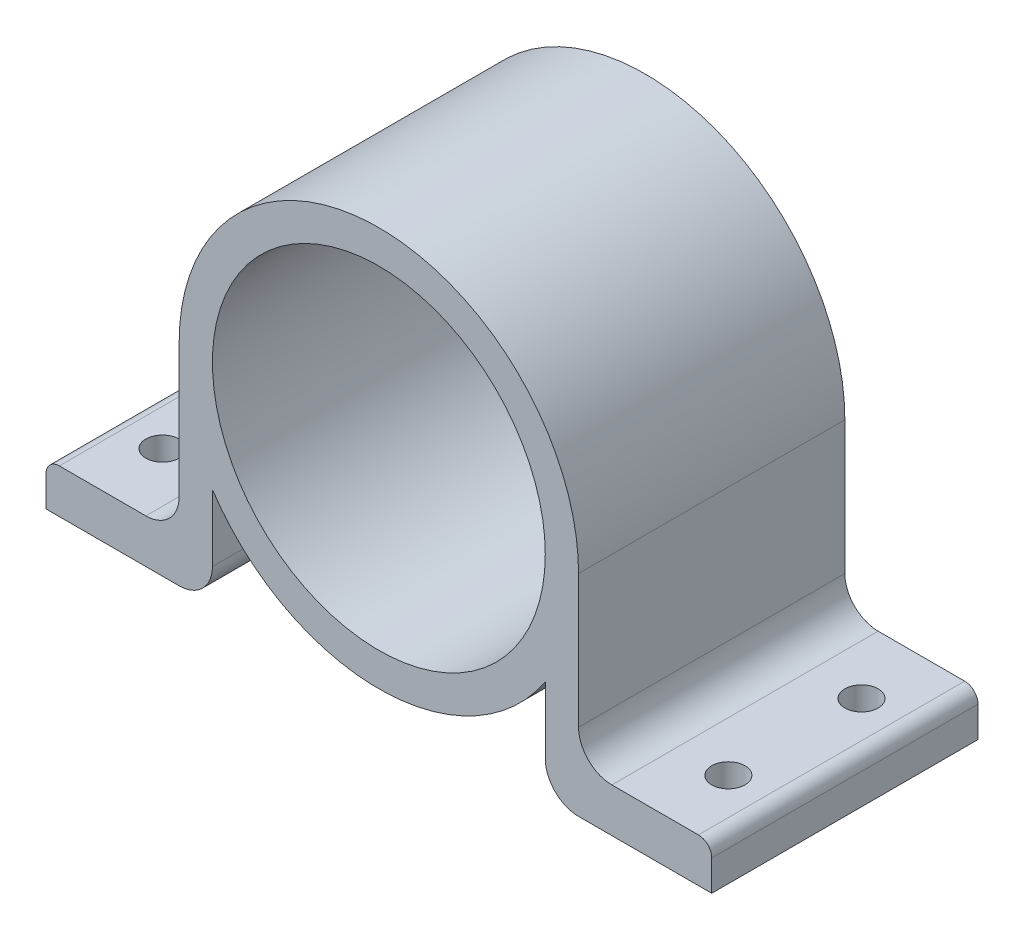
from build123d import *

# Parameters (mm, degrees)
SKETCH1_R           = 12.5
BOSS_EXTRUDE1_DEPTH = 20
FILLET1_R           = 2.5
CUT_EXTRUDE1_REACH  = 44.205
SKETCH2_R           = 1.25
FILLET3_R           = 1
FILLET4_R           = 2.5


with BuildPart() as part:
    # Sketch1 → Boss-Extrude1 (new body)
    with BuildSketch(Plane.XY):
        with BuildLine():
            Line((-25, 6.526152156), (-15, 6.526152156))
            Line((-15, 6.526152156), (-15, 19.026152156))
            ThreePointArc((-15, 19.026152156), (0, 34.026152156), (15, 19.026152156))
            Line((15, 19.026152156), (15, 6.526152156))
            Line((15, 6.526152156), (25, 6.526152156))
            Line((25, 6.526152156), (25, 3.226152156))
            Line((25, 3.226152156), (12.5, 3.226152156))
            Line((12.5, 3.226152156), (12.5, 10.73459018))
            ThreePointArc((12.5, 10.73459018), (0, 4.026152156), (-12.5, 10.73459018))
            Line((-12.5, 10.73459018), (-12.5, 3.226152156))
            Line((-12.5, 3.226152156), (-25, 3.226152156))
            Line((-25, 3.226152156), (-25, 6.526152156))
        make_face()
        with Locations((0, 19.026152156)):
            Circle(SKETCH1_R, mode=Mode.SUBTRACT)
    extrude(amount=BOSS_EXTRUDE1_DEPTH)

    # Fillet1
    fillet1_edges = [part.edges().sort_by_distance(p)[0] for p in [
        (-15, 6.526152156, 10),
        (15, 6.526152156, 10),
    ]]
    fillet(fillet1_edges, radius=FILLET1_R)

    # Sketch2 → Cut-Extrude1 (cut, up to next)
    with BuildSketch(Plane(origin=(0, 6.526152156, 0), x_dir=(1, 0, 0), z_dir=(0, 1, 0)), mode=Mode.PRIVATE) as cut_extrude1_sk1:
        with Locations(Location((-21.25, -5, 0), (0, 0, 270))):
            Circle(SKETCH2_R)
    cut_extrude1_tool1 = extrude(cut_extrude1_sk1.sketch, amount=-CUT_EXTRUDE1_REACH, mode=Mode.PRIVATE) & part.part
    # Sketch2 → Cut-Extrude1 (cut, up to next)
    with BuildSketch(Plane(origin=(0, 6.526152156, 0), x_dir=(1, 0, 0), z_dir=(0, 1, 0)), mode=Mode.PRIVATE) as cut_extrude1_sk2:
        with Locations(Location((-21.25, -15, 0), (0, 0, 270))):
            Circle(SKETCH2_R)
    cut_extrude1_tool2 = extrude(cut_extrude1_sk2.sketch, amount=-CUT_EXTRUDE1_REACH, mode=Mode.PRIVATE) & part.part
    # Sketch2 → Cut-Extrude1 (cut, up to next)
    with BuildSketch(Plane(origin=(0, 6.526152156, 0), x_dir=(1, 0, 0), z_dir=(0, 1, 0)), mode=Mode.PRIVATE) as cut_extrude1_sk3:
        with Locations(Location((21.25, -5, 0), (0, 0, 270))):
            Circle(SKETCH2_R)
    cut_extrude1_tool3 = extrude(cut_extrude1_sk3.sketch, amount=-CUT_EXTRUDE1_REACH, mode=Mode.PRIVATE) & part.part
    # Sketch2 → Cut-Extrude1 (cut, up to next)
    with BuildSketch(Plane(origin=(0, 6.526152156, 0), x_dir=(1, 0, 0), z_dir=(0, 1, 0)), mode=Mode.PRIVATE) as cut_extrude1_sk4:
        with Locations(Location((21.25, -15, 0), (0, 0, 270))):
            Circle(SKETCH2_R)
    cut_extrude1_tool4 = extrude(cut_extrude1_sk4.sketch, amount=-CUT_EXTRUDE1_REACH, mode=Mode.PRIVATE) & part.part
    add(cut_extrude1_tool1.solids().sort_by_distance((-21.25, 6.526152, 5))[0], mode=Mode.SUBTRACT)
    add(cut_extrude1_tool2.solids().sort_by_distance((-21.25, 6.526152, 15))[0], mode=Mode.SUBTRACT)
    add(cut_extrude1_tool3.solids().sort_by_distance((21.25, 6.526152, 5))[0], mode=Mode.SUBTRACT)
    add(cut_extrude1_tool4.solids().sort_by_distance((21.25, 6.526152, 15))[0], mode=Mode.SUBTRACT)

    # Fillet3
    fillet3_edges = [part.edges().sort_by_distance(p)[0] for p in [
        (-25, 6.526152156, 10),
        (25, 6.526152156, 10),
    ]]
    fillet(fillet3_edges, radius=FILLET3_R)

    # Fillet4
    fillet4_edges = [part.edges().sort_by_distance(p)[0] for p in [
        (-12.5, 3.226152156, 10),
        (12.5, 3.226152156, 10),
    ]]
    fillet(fillet4_edges, radius=FILLET4_R)


solid = part.part
